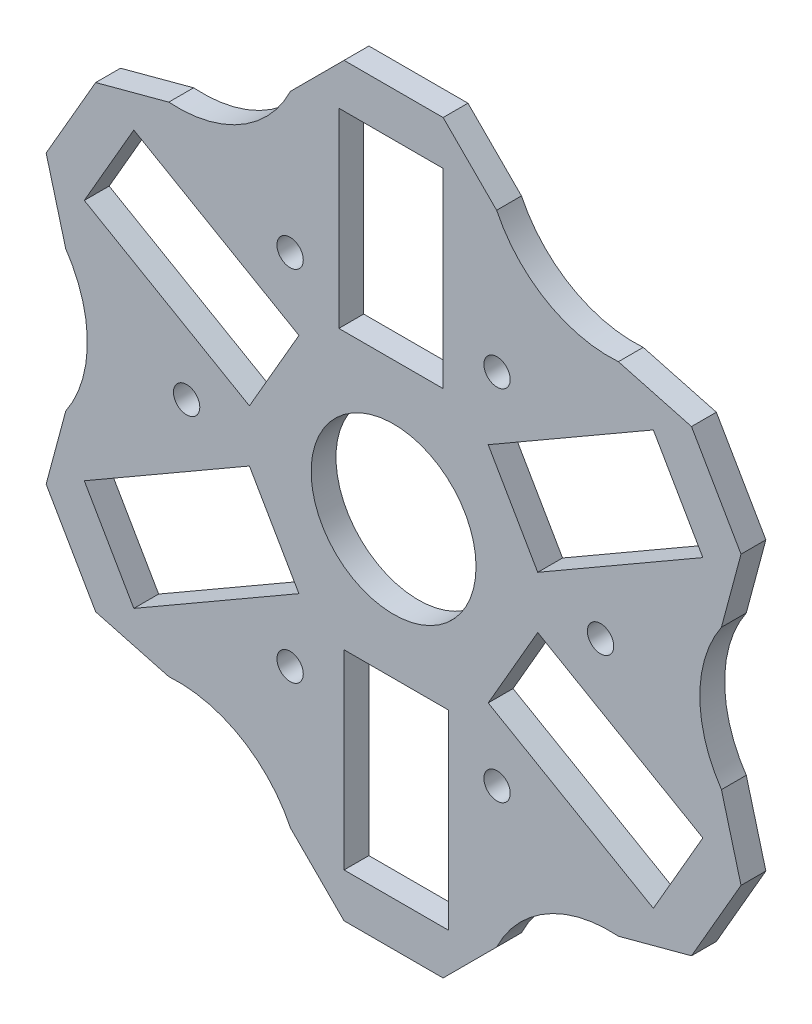
from build123d import *

# Parameters (mm, degrees)
BOSS_EXTRUDE1_DEPTH      = 1.5
BOSS_EXTRUDE1_DEPTH_BACK = 1.5
SKETCH2_W                = 12.59
SKETCH2_H                = 23.03
CUT_EXTRUDE1_DEPTH       = 3
SKETCH3_W                = 12.59
SKETCH3_H                = 23.03
CUT_EXTRUDE2_DEPTH       = 3
CUT_EXTRUDE3_DEPTH       = 3
CUT_EXTRUDE4_DEPTH       = 3
CUT_EXTRUDE5_DEPTH       = 3
CUT_EXTRUDE6_DEPTH       = 3
SKETCH8_R                = 9.96
CUT_EXTRUDE7_DEPTH       = 3
SKETCH9_R                = 1.59
CUT_EXTRUDE8_DEPTH       = 3
SKETCH10_R               = 1.59
CUT_EXTRUDE9_DEPTH       = 3


with BuildPart() as part:
    # Sketch1 → Boss-Extrude1 (new, two sides: drawn at the far end of the back side and taken through both)
    with BuildSketch(Plane.XY.offset(-BOSS_EXTRUDE1_DEPTH_BACK)):
        with BuildLine():
            Line((98.253494636, -20.43499635), (104.23425822, -10.0760127))
            Line((104.23425822, -10.0760127), (113.064881921, -7.709853588))
            ThreePointArc((113.064881921, -7.709853588), (121.722656845, -5.725791507), (127.769789966, 0.780032806))
            Line((127.769789966, 0.780032806), (134.234253695, 7.24450012))
            Line((134.234253695, 7.24450012), (146.195780864, 7.24450012))
            Line((146.195780864, 7.24450012), (152.660249109, 0.78003546))
            ThreePointArc((152.660249109, 0.78003546), (158.707381887, -5.725786628), (167.365155021, -7.709848177))
            Line((167.365155021, -7.709848177), (176.195776859, -10.076007288))
            Line((176.195776859, -10.076007288), (182.176542181, -20.434992087))
            Line((182.176542181, -20.434992087), (179.810382355, -29.265616594))
            ThreePointArc((179.810382355, -29.265616594), (177.199740829, -37.75550103), (179.810382355, -46.245385467))
            Line((179.810382355, -46.245385467), (182.176541113, -55.07600785))
            Line((182.176541113, -55.07600785), (176.195778722, -65.434989434))
            Line((176.195778722, -65.434989434), (167.365155827, -67.801148329))
            ThreePointArc((167.365155827, -67.801148329), (158.707382848, -69.785210553), (152.660250576, -76.291033111))
            Line((152.660250576, -76.291033111), (146.195785916, -82.755501356))
            Line((146.195785916, -82.755501356), (134.234258747, -82.755501356))
            Line((134.234258747, -82.755501356), (127.769791434, -76.291037627))
            ThreePointArc((127.769791434, -76.291037627), (121.722657806, -69.785213784), (113.064882728, -67.801152377))
            Line((113.064882728, -67.801152377), (104.23425822, -65.434992551))
            Line((104.23425822, -65.434992551), (98.253494636, -55.076010763))
            Line((98.253494636, -55.076010763), (100.619653747, -46.245388924))
            ThreePointArc((100.619653747, -46.245388924), (103.230295273, -37.755504488), (100.619653747, -29.265620052))
            Line((100.619653747, -29.265620052), (98.253494636, -20.43499635))
        make_face()
    extrude(amount=BOSS_EXTRUDE1_DEPTH + BOSS_EXTRUDE1_DEPTH_BACK)

    # Sketch2 → Cut-Extrude1 (cut)
    with BuildSketch(Plane.XY.offset(1.5)):
        with Locations((139.900780864, -9.59049988)):
            Rectangle(SKETCH2_W, SKETCH2_H)
    extrude(amount=-CUT_EXTRUDE1_DEPTH, mode=Mode.SUBTRACT)

    # Sketch3 → Cut-Extrude2 (cut)
    with BuildSketch(Plane.XY.offset(1.5)):
        with Locations((140.529262159, -65.920502947)):
            Rectangle(SKETCH3_W, SKETCH3_H)
    extrude(amount=-CUT_EXTRUDE2_DEPTH, mode=Mode.SUBTRACT)

    # Sketch4 → Cut-Extrude3 (cut)
    with BuildSketch(Plane.XY.offset(1.5)):
        Polygon((171.588522223, -12.736008176), (151.64395758, -24.251013064), (157.624720423, -34.609993567), (177.569285268, -23.094993214), align=None)
    extrude(amount=-CUT_EXTRUDE3_DEPTH, mode=Mode.SUBTRACT)

    # Sketch5 → Cut-Extrude4 (cut)
    with BuildSketch(Plane.XY.offset(1.5)):
        Polygon((102.86074998, -52.416011103), (122.80531503, -40.901011103), (128.786075877, -51.259992759), (108.841510828, -62.774992759), align=None)
    extrude(amount=-CUT_EXTRUDE4_DEPTH, mode=Mode.SUBTRACT)

    # Sketch6 → Cut-Extrude5 (cut)
    with BuildSketch(Plane.XY.offset(1.5)):
        Polygon((108.841512319, -12.736014517), (128.78607799, -24.25101344), (122.805317347, -34.609996033), (102.860751676, -23.094997111), align=None)
    extrude(amount=-CUT_EXTRUDE5_DEPTH, mode=Mode.SUBTRACT)

    # Sketch7 → Cut-Extrude6 (cut)
    with BuildSketch(Plane.XY.offset(1.5)):
        Polygon((151.643959507, -51.25999177), (171.588525178, -62.774990693), (177.569285821, -52.416008099), (157.62472015, -40.901009176), align=None)
    extrude(amount=-CUT_EXTRUDE6_DEPTH, mode=Mode.SUBTRACT)

    # Sketch8 → Cut-Extrude7 (cut)
    with BuildSketch(Plane.XY.offset(1.5)):
        with Locations((140.215021511, -37.755501414)):
            Circle(SKETCH8_R)
    extrude(amount=-CUT_EXTRUDE7_DEPTH, mode=Mode.SUBTRACT)

    # Sketch9 → Cut-Extrude8 (cut)
    with BuildSketch(Plane.XY.offset(1.5)):
        with Locations((127.717657389, -59.401568952)):
            Circle(SKETCH9_R)
    extrude(amount=-CUT_EXTRUDE8_DEPTH, mode=Mode.SUBTRACT)

    # Sketch10 → Cut-Extrude9 (cut)
    with BuildSketch(Plane.XY.offset(1.5)):
        with Locations((152.712382304, -16.10943146)):
            Circle(SKETCH10_R)
        with Locations((165.209740829, -37.75550103)):
            Circle(SKETCH10_R)
        with Locations((115.220295273, -37.75550103)):
            Circle(SKETCH10_R)
        with Locations((127.717654681, -16.10943146)):
            Circle(SKETCH10_R)
        with Locations((152.712382304, -59.40156591)):
            Circle(SKETCH10_R)
    extrude(amount=-CUT_EXTRUDE9_DEPTH, mode=Mode.SUBTRACT)


solid = part.part
